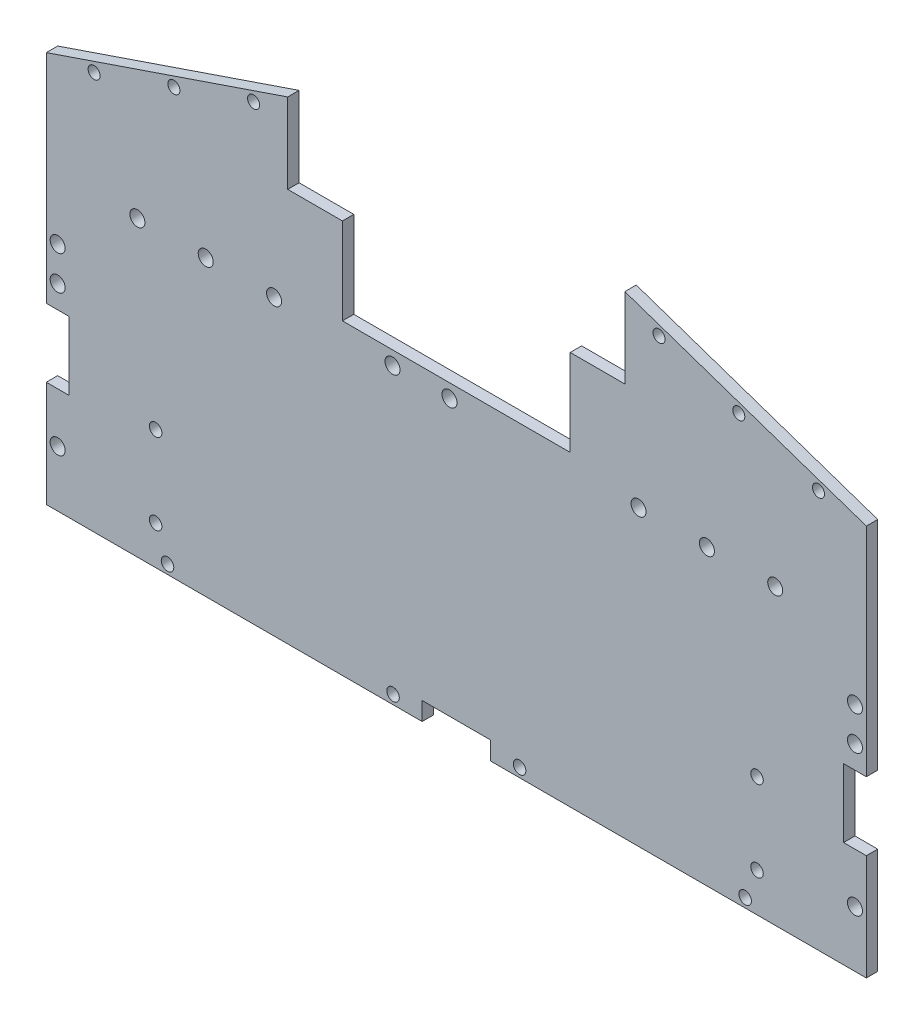
from build123d import *

# Parameters (mm, degrees)
RESSALTO_EXTRUS_O1_DEPTH         = 5
ESBO_O2_W                        = 10
ESBO_O2_H                        = 30
ESBO_O2_W_2                      = 30
ESBO_O2_H_2                      = 8
CORTE_EXTRUS_O1_DEPTH            = 5
RESSALTO_EXTRUS_O2_DEPTH         = 5
FURO_COM_FOLGA_DE_M61_D          = 6.6
FURO_COM_FOLGA_DE_M51_D          = 5.5
CORTE_EXTRUS_O2_DEPTH            = 427.059799089
ESBO_O9_W                        = 4
ESBO_O9_H                        = 100
CORTE_EXTRUS_O3_DEPTH            = 417.461117513
FURO_COM_FOLGA_DE_M52_AT_2_COUNT = 2
FURO_COM_FOLGA_DE_M52_AT_2_PITCH = 36.977943225
FURO_COM_FOLGA_DE_M52_AT_3_COUNT = 2
FURO_COM_FOLGA_DE_M52_AT_3_PITCH = 73.955886449


with BuildPart() as part:
    # Esboço1 → Ressalto-extrusão1 (new body)
    with BuildSketch(Plane.XY):
        Polygon((230, 172.82), (360, 172.82), (360, 0), (0, 0), (0, 172.82), (130, 172.82), (130, 134.82), (230, 134.82), align=None)
    extrude(amount=RESSALTO_EXTRUS_O1_DEPTH)

    # Esboço2 → Corte-extrusão1 (cut)
    with BuildSketch(Plane.XY.offset(5)):
        with Locations((5, 61.5)):
            Rectangle(ESBO_O2_W, ESBO_O2_H)
        with Locations((355, 61.5)):
            Rectangle(ESBO_O2_W, ESBO_O2_H)
        with Locations((180, 4)):
            Rectangle(ESBO_O2_W_2, ESBO_O2_H_2)
    extrude(amount=-CORTE_EXTRUS_O1_DEPTH, mode=Mode.SUBTRACT)

    # Esboço3 → Ressalto-extrusão2 (add)
    with BuildSketch(Plane.XY.offset(5)):
        Polygon((360, 172.82), (360, 187.82), (250, 227.82), (250, 172.82), align=None)
        Polygon((0, 187.82), (110, 227.82), (110, 172.82), (0, 172.82), align=None)
    extrude(amount=-RESSALTO_EXTRUS_O2_DEPTH)

    # Furo com folga de M61 (through all)
    with Locations(Plane(origin=(0, 0, 0), x_dir=(-1, 0, 0), z_dir=(0, 0, -1))):
        with Locations((-355, 24.65), (-355, 86.5), (-5, 24.65), (-5, 86.5), (-320, 128.82), (-290, 128.82), (-70, 128.82), (-40, 128.82), (-177, 128.82), (-355, 101.5), (-5, 101.5), (-260, 128.82), (-100, 128.82), (-152, 128.82)):
            Hole(FURO_COM_FOLGA_DE_M61_D / 2)

    # Furo com folga de M51 (through all)
    with Locations(Plane(origin=(0, 0, 0), x_dir=(-1, 0, 0), z_dir=(0, 0, -1))):
        with Locations((-312, 17), (-312, 52.5), (-306.78, 4), (-207.78, 4), (-152.22, 4), (-53.22, 4)):
            furo_com_folga_de_m51 = Hole(FURO_COM_FOLGA_DE_M51_D / 2)

    # Espelhar1: Furo com folga de M51 across plane
    add(furo_com_folga_de_m51.mirror(Plane(origin=(180, 0, 0), x_dir=(0, 0, 1), z_dir=(1, 0, 0))), mode=Mode.SUBTRACT)

    # Esboço8 → Corte-extrusão2 (cut, through all)
    with BuildSketch(Plane.XY.offset(5)):
        Polygon((0, 187.82), (110, 227.82), (110, 209.32), (0, 171.82), align=None)
        Polygon((250, 209.32), (360, 171.82), (360, 187.82), (250, 227.82), align=None)
    extrude(amount=-CORTE_EXTRUS_O2_DEPTH, mode=Mode.SUBTRACT)

    # Esboço9 → Corte-extrusão3 (cut, through all)
    with BuildSketch(Plane.XY.offset(5)):
        with Locations((108, 222.82)):
            Rectangle(ESBO_O9_W, ESBO_O9_H)
        with Locations((252, 222.82)):
            Rectangle(ESBO_O9_W, ESBO_O9_H)
    extrude(amount=-CORTE_EXTRUS_O3_DEPTH, mode=Mode.SUBTRACT)

    # Esboço11 → Furo com folga de M52 (revolve, cut)
    with BuildSketch(Plane(origin=(91, 198.616676618, 5), x_dir=(0, -1, 0), z_dir=(1, 0, 0))):
        Polygon((0, 0), (0, 16.59228064), (2.65, 15), (2.65, 0), align=None)
    furo_com_folga_de_m52 = revolve(axis=Axis((91, 198.616676618, 11.35), (0, 0, -1)), mode=Mode.SUBTRACT)

    # Furo com folga de M52 at 2: Furo com folga de M52 ×2
    with Locations(*[Vector(-0.94651018817854, -0.3226739277881387, 0) * (i * FURO_COM_FOLGA_DE_M52_AT_2_PITCH) for i in range(1, FURO_COM_FOLGA_DE_M52_AT_2_COUNT)]):
        add(furo_com_folga_de_m52, mode=Mode.SUBTRACT)

    # Furo com folga de M52 at 3: Furo com folga de M52 ×2
    with Locations(*[Vector(-0.9465101881785398, -0.322673927788139, 0) * (i * FURO_COM_FOLGA_DE_M52_AT_3_PITCH) for i in range(1, FURO_COM_FOLGA_DE_M52_AT_3_COUNT)]):
        add(furo_com_folga_de_m52, mode=Mode.SUBTRACT)

    # Espelhar2: Furo com folga de M52 across plane
    add(furo_com_folga_de_m52.mirror(Plane(origin=(180, 0, 0), x_dir=(0, 0, 1), z_dir=(1, 0, 0))), mode=Mode.SUBTRACT)

    # Espelhar2 copy 1 sketch → Espelhar2 copy 1 (revolve, cut)
    with BuildSketch(Plane(origin=(304, 186.684858437, 5), x_dir=(0, -1, 0), z_dir=(-1, 0, 0))):
        Polygon((0, 0), (0, -16.59228064), (2.65, -15), (2.65, 0), align=None)
    revolve(axis=Axis((304, 186.684858437, 11.35), (0, 0, 1)), mode=Mode.SUBTRACT)

    # Espelhar2 copy 2 sketch → Espelhar2 copy 2 (revolve, cut)
    with BuildSketch(Plane(origin=(339, 174.753040255, 5), x_dir=(0, -1, 0), z_dir=(-1, 0, 0))):
        Polygon((0, 0), (0, -16.59228064), (2.65, -15), (2.65, 0), align=None)
    revolve(axis=Axis((339, 174.753040255, 11.35), (0, 0, 1)), mode=Mode.SUBTRACT)


solid = part.part
